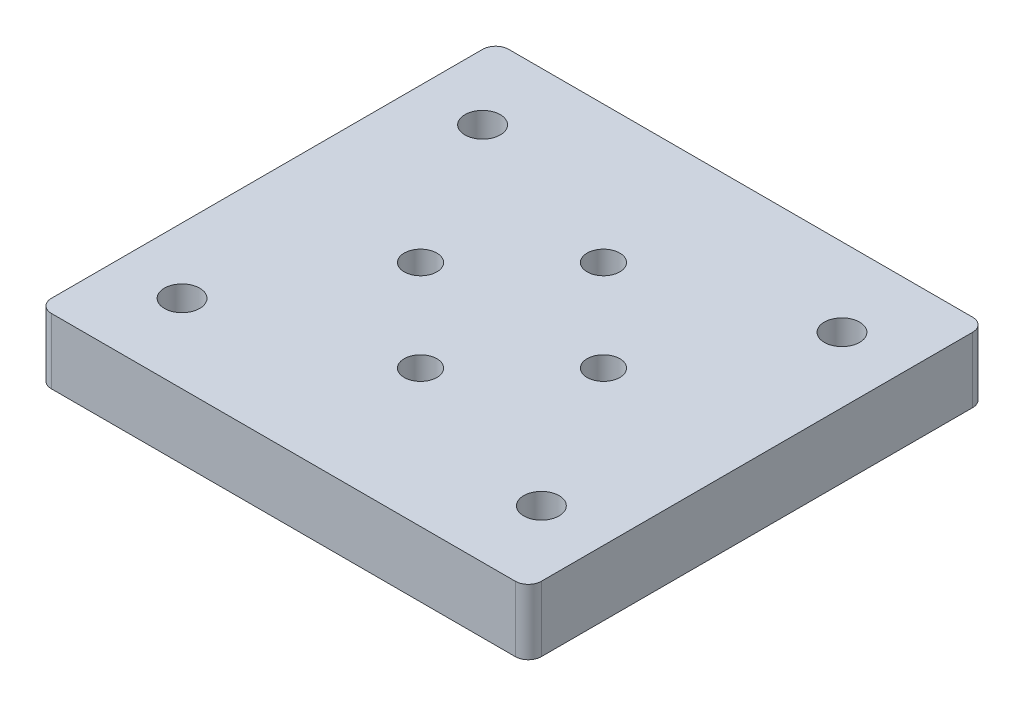
from build123d import *

# Parameters (mm, degrees)
SKETCH1_R           = 11
SKETCH1_R_2         = 1.25
BOSS_EXTRUDE1_DEPTH = 5
SKETCH2_R           = 1.35
SKETCH2_R_2         = 1.25
BOSS_EXTRUDE2_DEPTH = 5
FILLET1_R           = 0.5


with BuildPart() as part:
    # Sketch1 → Boss-Extrude1 (new body)
    with BuildSketch(Plane(origin=(0, 0, 0), x_dir=(1, 0, 0), z_dir=(0, 1, 0))):
        with Locations(Location((0, 0, 0), (0, 0, 270))):
            Circle(SKETCH1_R)
        with Locations(Location((0, 7, 0), (0, 0, 270))):
            Circle(SKETCH1_R_2, mode=Mode.SUBTRACT)
        with Locations(Location((7, 0, 0), (0, 0, 270))):
            Circle(SKETCH1_R_2, mode=Mode.SUBTRACT)
        with Locations(Location((0, -7, 0), (0, 0, 270))):
            Circle(SKETCH1_R_2, mode=Mode.SUBTRACT)
        with Locations(Location((-7, 0, 0), (0, 0, 270))):
            Circle(SKETCH1_R_2, mode=Mode.SUBTRACT)
    extrude(amount=BOSS_EXTRUDE1_DEPTH)

    # Sketch2 → Boss-Extrude2 (add)
    with BuildSketch(Plane(origin=(0, 5, 0), x_dir=(1, 0, 0), z_dir=(0, 1, 0))):
        with BuildLine():
            ThreePointArc((-18.75, -16.5), (-18.457106781, -17.207106781), (-17.75, -17.5))
            Line((-17.75, -17.5), (17.75, -17.5))
            ThreePointArc((17.75, -17.5), (18.457106781, -17.207106781), (18.75, -16.5))
            Line((18.75, -16.5), (18.75, 16.5))
            ThreePointArc((18.75, 16.5), (18.457106781, 17.207106781), (17.75, 17.5))
            Line((17.75, 17.5), (-17.75, 17.5))
            ThreePointArc((-17.75, 17.5), (-18.457106781, 17.207106781), (-18.75, 16.5))
            Line((-18.75, 16.5), (-18.75, -16.5))
        make_face()
        with Locations(Location((-13.75, -11.5, 0), (0, 0, 270))):
            Circle(SKETCH2_R, mode=Mode.SUBTRACT)
        with Locations(Location((13.75, -11.5, 0), (0, 0, 270))):
            Circle(SKETCH2_R, mode=Mode.SUBTRACT)
        with Locations(Location((-13.75, 11.5, 0), (0, 0, 270))):
            Circle(SKETCH2_R, mode=Mode.SUBTRACT)
        with Locations(Location((13.75, 11.5, 0), (0, 0, 270))):
            Circle(SKETCH2_R, mode=Mode.SUBTRACT)
        with Locations(Location((0, 7, 0), (0, 0, 270))):
            Circle(SKETCH2_R_2, mode=Mode.SUBTRACT)
        with Locations(Location((0, -7, 0), (0, 0, 270))):
            Circle(SKETCH2_R_2, mode=Mode.SUBTRACT)
        with Locations(Location((-7, 0, 0), (0, 0, 270))):
            Circle(SKETCH2_R_2, mode=Mode.SUBTRACT)
        with Locations(Location((7, 0, 0), (0, 0, 270))):
            Circle(SKETCH2_R_2, mode=Mode.SUBTRACT)
    extrude(amount=BOSS_EXTRUDE2_DEPTH)

    # Fillet1
    fillet1_edges = [part.edges().sort_by_distance(p)[0] for p in [
        (0, 5, -11),
    ]]
    fillet(fillet1_edges, radius=FILLET1_R)


solid = part.part
